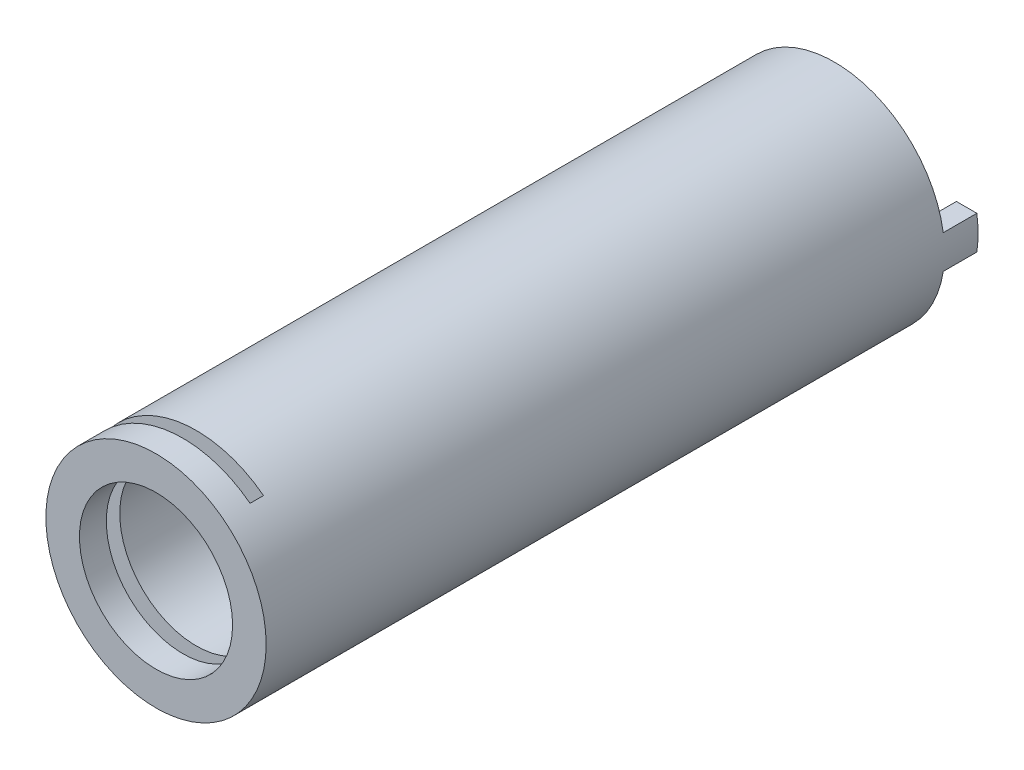
from build123d import *

# Parameters (mm, degrees)
SKETCH1_R               = 16.4
SKETCH1_R_2             = 11.4
BOSS_EXTRUDE1_DEPTH     = 101
CUT_EXTRUDE1_DEPTH      = 10.0001
CUT_EXTRUDE1_DEPTH_BACK = 100
SKETCH2_W               = 2
SKETCH2_H               = 49.498063887
BOSS_EXTRUDE2_START     = 5
BOSS_EXTRUDE2_DEPTH     = 5


with BuildPart() as part:
    # Sketch1 → Boss-Extrude1 (new body)
    with BuildSketch(Plane.XY):
        Circle(SKETCH1_R)
        Circle(SKETCH1_R_2, mode=Mode.SUBTRACT)
    extrude(amount=BOSS_EXTRUDE1_DEPTH)

    # Sketch2 → Cut-Extrude1 (cut, two sides: drawn at the far end of the back side and taken through both)
    with BuildSketch(Plane(origin=(0, 0, 0), x_dir=(0, 0, -1), z_dir=(1, 0, 0)).offset(-CUT_EXTRUDE1_DEPTH_BACK)):
        with Locations((-96, 0.830504428)):
            Rectangle(SKETCH2_W, SKETCH2_H)
    extrude(amount=CUT_EXTRUDE1_DEPTH + CUT_EXTRUDE1_DEPTH_BACK, mode=Mode.SUBTRACT)

    # Sketch3 → Boss-Extrude2 (add)
    with BuildSketch(Plane(origin=(0, 0, 0), x_dir=(-1, 0, 0), z_dir=(0, 0, -1)).offset(BOSS_EXTRUDE2_START)):
        with BuildLine():
            Line((13.164725595, 2.5), (16.208331191, 2.5))
            ThreePointArc((16.208331191, 2.5), (16.4, 0), (16.208331191, -2.5))
            Line((16.208331191, -2.5), (13.164725595, -2.5))
            ThreePointArc((13.164725595, -2.5), (13.4, 0), (13.164725595, 2.5))
        make_face()
        with BuildLine():
            Line((-16.208331191, 2.5), (-13.164725595, 2.5))
            ThreePointArc((-13.164725595, 2.5), (-13.4, 0), (-13.164725595, -2.5))
            Line((-13.164725595, -2.5), (-16.208331191, -2.5))
            ThreePointArc((-16.208331191, -2.5), (-16.4, 0), (-16.208331191, 2.5))
        make_face()
    extrude(amount=-BOSS_EXTRUDE2_DEPTH)


solid = part.part
